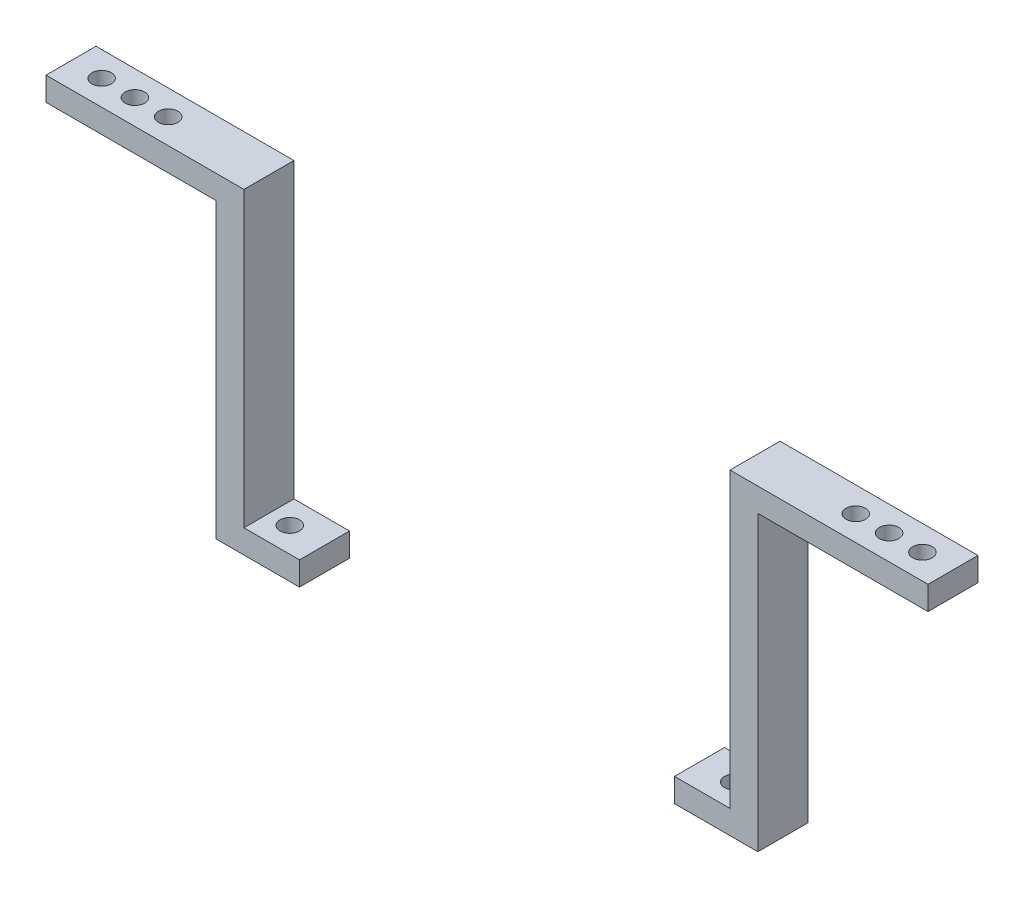
from build123d import *

# Parameters (mm, degrees)
SKETCH1_W             = 15.24
SKETCH1_H             = 9.144
SKETCH1_R             = 1.778
BOSS_EXTRUDE1_DEPTH   = 4.318
BOSS_EXTRUDE1_2_DEPTH = 4.318
SKETCH2_W             = 5.08
SKETCH2_H             = 9.144
BOSS_EXTRUDE2_DEPTH   = 49.276
SKETCH3_W             = 36.195
SKETCH3_H             = 9.144
BOSS_EXTRUDE3_DEPTH   = 4.318
SKETCH4_R             = 1.778
CUT_EXTRUDE1_DEPTH    = 100.389732634
SKETCH5_R             = 1.778
CUT_EXTRUDE2_DEPTH    = 100.389732634


with BuildPart() as part:
    # Sketch1 → Boss-Extrude1 (new body)
    with BuildSketch(Plane(origin=(0, 0, 0), x_dir=(1, 0, 0), z_dir=(0, 1, 0))):
        with Locations((-41.91, 0)):
            Rectangle(SKETCH1_W, SKETCH1_H)
        with Locations(Location((-40.64, 0, 0), (0, 0, 270))):
            Circle(SKETCH1_R, mode=Mode.SUBTRACT)
    extrude(amount=BOSS_EXTRUDE1_DEPTH)



with BuildPart() as body_2:
    # Sketch1 → Boss-Extrude1 2 (new body)
    with BuildSketch(Plane(origin=(0, 0, 0), x_dir=(1, 0, 0), z_dir=(0, 1, 0))):
        with Locations((41.91, 0)):
            Rectangle(SKETCH1_W, SKETCH1_H)
        with Locations(Location((40.64, 0, 0), (0, 0, 270))):
            Circle(SKETCH1_R, mode=Mode.SUBTRACT)
    extrude(amount=BOSS_EXTRUDE1_2_DEPTH)


with BuildPart() as part_1:
    add(part.part)

    add(body_2.part)  # Boss-Extrude2 merges body 2
    # Sketch2 → Boss-Extrude2 (add)
    with BuildSketch(Plane(origin=(0, 4.318, 0), x_dir=(1, 0, 0), z_dir=(0, 1, 0))):
        with Locations((-46.99, 0)):
            Rectangle(SKETCH2_W, SKETCH2_H)
        with Locations((46.99, 0)):
            Rectangle(SKETCH2_W, SKETCH2_H)
    extrude(amount=BOSS_EXTRUDE2_DEPTH)

    # Sketch3 → Boss-Extrude3 (add)
    with BuildSketch(Plane(origin=(0, 53.594, 0), x_dir=(1, 0, 0), z_dir=(0, 1, 0))):
        with Locations((-62.5475, 0)):
            Rectangle(SKETCH3_W, SKETCH3_H)
        with Locations((62.5475, 0)):
            Rectangle(SKETCH3_W, SKETCH3_H)
    extrude(amount=BOSS_EXTRUDE3_DEPTH)

    # Sketch4 → Cut-Extrude1 (cut, through all)
    with BuildSketch(Plane(origin=(0, 57.912, 0), x_dir=(1, 0, 0), z_dir=(0, 1, 0))):
        with Locations(Location((-75.057, 0, 0), (0, 0, 270))):
            Circle(SKETCH4_R)
        with Locations(Location((75.057, 0, 0), (0, 0, 270))):
            Circle(SKETCH4_R)
    extrude(amount=-CUT_EXTRUDE1_DEPTH, mode=Mode.SUBTRACT)

    # Sketch5 → Cut-Extrude2 (cut, through all)
    with BuildSketch(Plane(origin=(0, 57.912, 0), x_dir=(1, 0, 0), z_dir=(0, 1, 0))):
        with Locations(Location((-68.961, 0, 0), (0, 0, 270))):
            Circle(SKETCH5_R)
        with Locations(Location((-62.865, 0, 0), (0, 0, 270))):
            Circle(SKETCH5_R)
        with Locations(Location((62.865, 0, 0), (0, 0, 270))):
            Circle(SKETCH5_R)
        with Locations(Location((68.961, 0, 0), (0, 0, 270))):
            Circle(SKETCH5_R)
    extrude(amount=-CUT_EXTRUDE2_DEPTH, mode=Mode.SUBTRACT)


solid = part_1.part
